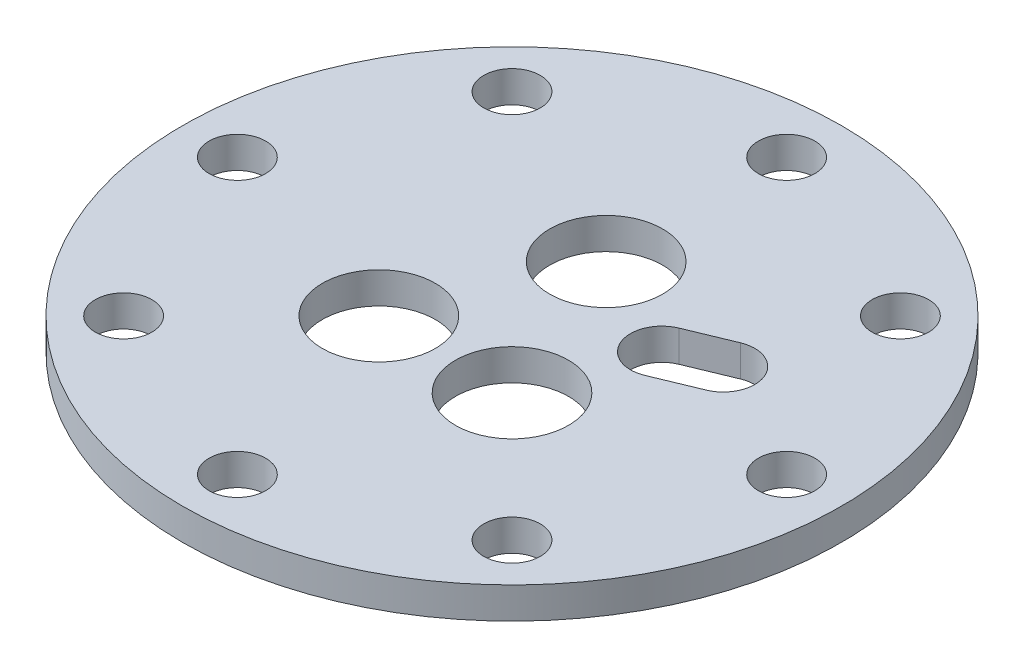
from build123d import *

# Parameters (mm, degrees)
SKETCH3_R           = 105
SKETCH3_R_2         = 18
SKETCH3_R_3         = 9
BOSS_EXTRUDE2_DEPTH = 10


with BuildPart() as part:
    # Sketch3 → Boss-Extrude2 (new body)
    with BuildSketch(Plane(origin=(0, 0, 0), x_dir=(1, 0, 0), z_dir=(0, 1, 0))):
        with Locations(Location((0, 0, 0), (0, 0, 270))):
            Circle(SKETCH3_R)
        with Locations(Location((-21.213203436, -21.213203436, 0), (0, 0, 270))):
            Circle(SKETCH3_R_2, mode=Mode.SUBTRACT)
        with Locations(Location((21.213203436, -21.213203436, 0), (0, 0, 270))):
            Circle(SKETCH3_R_2, mode=Mode.SUBTRACT)
        with Locations(Location((0, 30, 0), (0, 0, 270))):
            Circle(SKETCH3_R_2, mode=Mode.SUBTRACT)
        with Locations(Location((87.5, 0, 0), (0, 0, 270))):
            Circle(SKETCH3_R_3, mode=Mode.SUBTRACT)
        with Locations(Location((61.871843354, -61.871843354, 0), (0, 0, 270))):
            Circle(SKETCH3_R_3, mode=Mode.SUBTRACT)
        with Locations(Location((0, -87.5, 0), (0, 0, 270))):
            Circle(SKETCH3_R_3, mode=Mode.SUBTRACT)
        with Locations(Location((-61.871843354, -61.871843354, 0), (0, 0, 270))):
            Circle(SKETCH3_R_3, mode=Mode.SUBTRACT)
        with Locations(Location((-87.5, 0, 0), (0, 0, 270))):
            Circle(SKETCH3_R_3, mode=Mode.SUBTRACT)
        with Locations(Location((-61.871843354, 61.871843354, 0), (0, 0, 270))):
            Circle(SKETCH3_R_3, mode=Mode.SUBTRACT)
        with Locations(Location((61.871843354, 61.871843354, 0), (0, 0, 270))):
            Circle(SKETCH3_R_3, mode=Mode.SUBTRACT)
        with Locations(Location((0, 87.5, 0), (0, 0, 270))):
            Circle(SKETCH3_R_3, mode=Mode.SUBTRACT)
        with BuildLine():
            ThreePointArc((29.933258413, 23.222683604), (24.521297412, 10.157053955), (37.586927061, 4.745092953))
            Line((37.586927061, 4.745092953), (51.445120048, 10.485344439))
            ThreePointArc((51.445120048, 10.485344439), (56.85708105, 23.550974088), (43.791451401, 28.962935089))
            Line((43.791451401, 28.962935089), (29.933258413, 23.222683604))
        make_face(mode=Mode.SUBTRACT)
    extrude(amount=BOSS_EXTRUDE2_DEPTH)


solid = part.part
